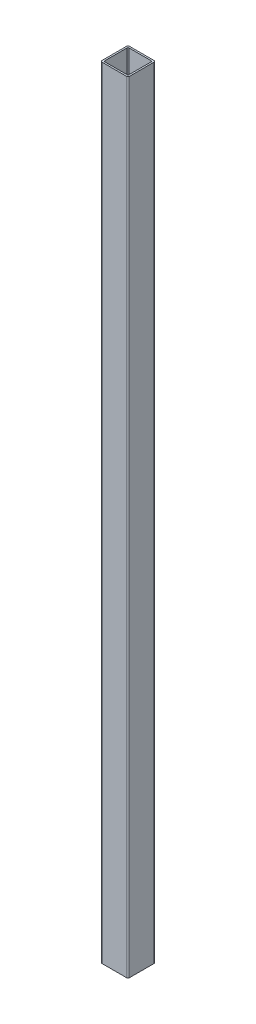
from build123d import *

# Parameters (mm, degrees)
EXTRUDE_1_DEPTH = 2842.536916465


with BuildPart() as part:
    # Эскиз1 → Бобышка-Вытянуть1 (new body)
    with BuildSketch(Plane(origin=(0, 0, 0), x_dir=(1, 0, 0), z_dir=(0, 1, 0))):
        with BuildLine():
            Line((-44, 50), (44, 50))
            ThreePointArc((44, 50), (48.242640687, 48.242640687), (50, 44))
            Line((50, 44), (50, -44))
            ThreePointArc((50, -44), (48.242640687, -48.242640687), (44, -50))
            Line((44, -50), (-44, -50))
            ThreePointArc((-44, -50), (-48.242640687, -48.242640687), (-50, -44))
            Line((-50, -44), (-50, 44))
            ThreePointArc((-50, 44), (-48.242640687, 48.242640687), (-44, 50))
        make_face()
        with BuildLine():
            Line((-40, 44), (40, 44))
            ThreePointArc((40, 44), (42.828427125, 42.828427125), (44, 40))
            Line((44, 40), (44, -40))
            ThreePointArc((44, -40), (42.828427125, -42.828427125), (40, -44))
            Line((40, -44), (-40, -44))
            ThreePointArc((-40, -44), (-42.828427125, -42.828427125), (-44, -40))
            Line((-44, -40), (-44, 40))
            ThreePointArc((-44, 40), (-42.828427125, 42.828427125), (-40, 44))
        make_face(mode=Mode.SUBTRACT)
    extrude(amount=EXTRUDE_1_DEPTH)


solid = part.part
